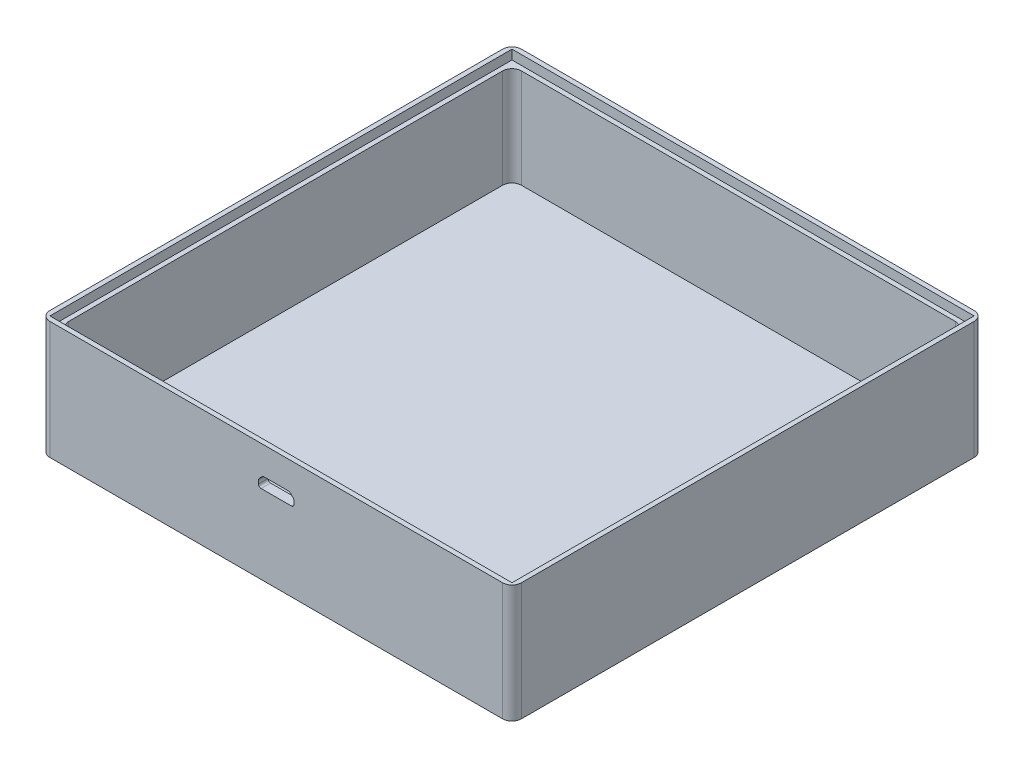
from build123d import *

# Parameters (mm, degrees)
BOSS_EXTRUDE1_DEPTH = 25
SHELL8_T            = -2
CUT_EXTRUDE1_DEPTH  = 76
SKETCH3_W           = 98
SKETCH3_H           = 98
CUT_EXTRUDE2_DEPTH  = 2
FILLET1_R           = 2
FILLET2_R           = 2


with BuildPart() as part:
    # Sketch1 → Boss-Extrude1 (new body)
    with BuildSketch(Plane(origin=(0, 0, 0), x_dir=(1, 0, 0), z_dir=(0, 1, 0))):
        Polygon((0, -50), (50, -50), (50, 50), (-50, 50), (-50, -50), align=None)
    extrude(amount=BOSS_EXTRUDE1_DEPTH)

    # Shell8
    shell8_openings = [part.faces().sort_by_distance(p)[0] for p in [
        (0, 25, 0),
    ]]
    offset(amount=SHELL8_T, openings=shell8_openings, kind=Kind.INTERSECTION)

    # Sketch2 → Cut-Extrude1 (cut, through all)
    with BuildSketch(Plane.XY):
        with BuildLine():
            ThreePointArc((3.75, 17.255), (3.58890873, 16.86609127), (3.2, 16.705))
            Line((3.2, 16.705), (-3.2, 16.705))
            ThreePointArc((-3.2, 16.705), (-3.58890873, 16.86609127), (-3.75, 17.255))
            Line((-3.75, 17.255), (-3.75, 18.001446611))
            ThreePointArc((-3.75, 18.001446611), (-3.708133743, 18.211922498), (-3.58890873, 18.390355339))
            Line((-3.58890873, 18.390355339), (-2.985355339, 18.99390873))
            ThreePointArc((-2.985355339, 18.99390873), (-2.806922497, 19.113133743), (-2.596446609, 19.155))
            Line((-2.596446609, 19.155), (2.596446609, 19.155))
            ThreePointArc((2.596446609, 19.155), (2.806922497, 19.113133743), (2.985355339, 18.99390873))
            Line((2.985355339, 18.99390873), (3.58890873, 18.390355339))
            ThreePointArc((3.58890873, 18.390355339), (3.708133743, 18.211922498), (3.75, 18.001446611))
            Line((3.75, 18.001446611), (3.75, 17.255))
        make_face()
    extrude(amount=CUT_EXTRUDE1_DEPTH, mode=Mode.SUBTRACT)

    # Sketch3 → Cut-Extrude2 (cut)
    with BuildSketch(Plane(origin=(0, 25, 0), x_dir=(1, 0, 0), z_dir=(0, 1, 0))):
        Rectangle(SKETCH3_W, SKETCH3_H)
    extrude(amount=-CUT_EXTRUDE2_DEPTH, mode=Mode.SUBTRACT)

    # Fillet1
    fillet1_edges = [part.edges().sort_by_distance(p)[0] for p in [
        (-50, 12.5, 50),
        (-50, 12.5, -50),
        (50, 12.5, -50),
        (50, 12.5, 50),
    ]]
    fillet(fillet1_edges, radius=FILLET1_R)

    # Fillet2
    fillet2_edges = [part.edges().sort_by_distance(p)[0] for p in [
        (-48, 12.5, -48),
        (-48, 12.5, 48),
        (48, 12.5, -48),
        (48, 12.5, 48),
    ]]
    fillet(fillet2_edges, radius=FILLET2_R)


solid = part.part
